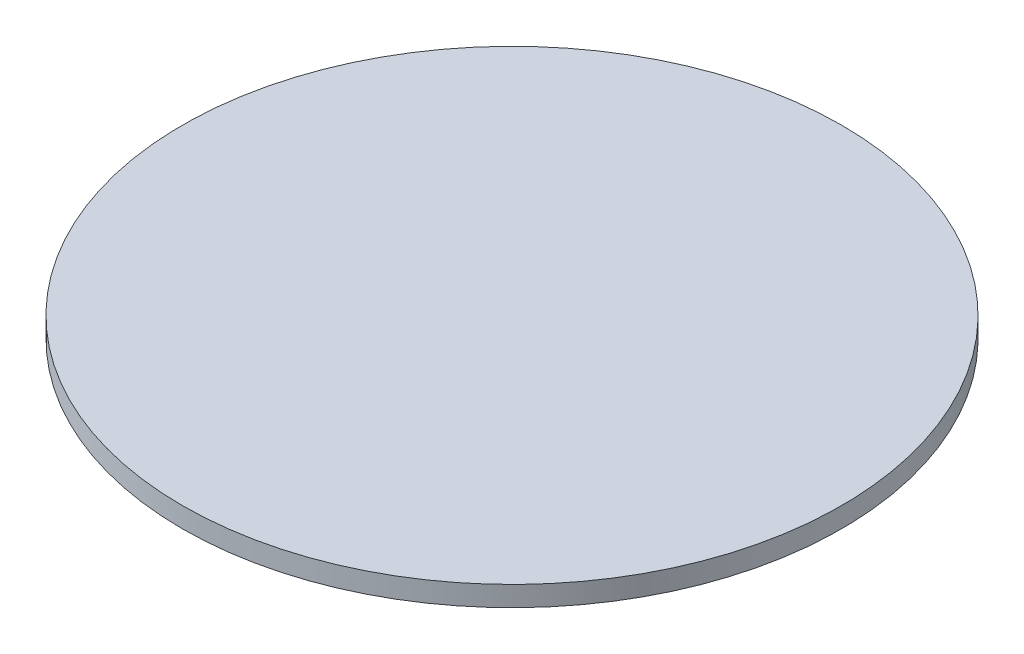
from build123d import *

# Parameters (mm, degrees)
SKETCH1_R           = 18
BOSS_EXTRUDE1_DEPTH = 1.1


with BuildPart() as part:
    # Sketch1 → Boss-Extrude1 (new body)
    with BuildSketch(Plane(origin=(0, 0, 0), x_dir=(1, 0, 0), z_dir=(0, 1, 0))):
        with Locations(Location((0, 0, 0), (0, 0, 270))):
            Circle(SKETCH1_R)
    extrude(amount=BOSS_EXTRUDE1_DEPTH)


solid = part.part
